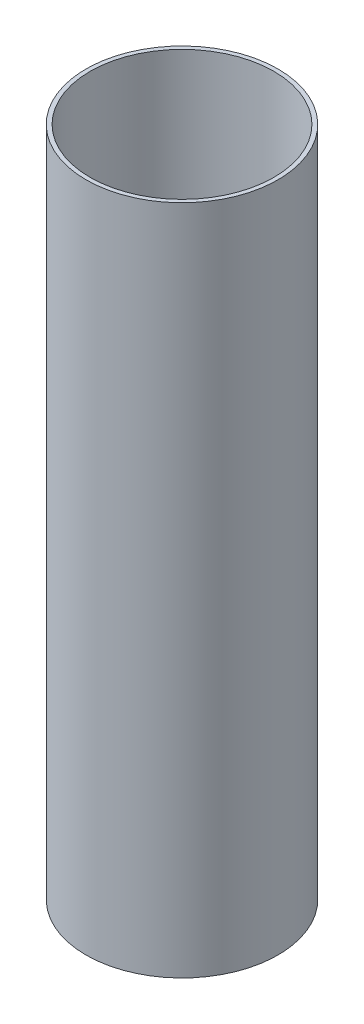
from build123d import *

# Parameters (mm, degrees)
SZKIC1_R                    = 64.775
SZKIC1_R_2                  = 62
DODANIE_WYCI_GNI_CIE1_DEPTH = 453


with BuildPart() as part:
    # Szkic1 → Dodanie-wyciągnięcie1 (new body)
    with BuildSketch(Plane(origin=(0, 0, 0), x_dir=(1, 0, 0), z_dir=(0, 1, 0))):
        with Locations(Location((0, 0, 0), (0, 0, 90))):
            Circle(SZKIC1_R)
        with Locations(Location((0, 0, 0), (0, 0, 90))):
            Circle(SZKIC1_R_2, mode=Mode.SUBTRACT)
    extrude(amount=DODANIE_WYCI_GNI_CIE1_DEPTH)


solid = part.part
